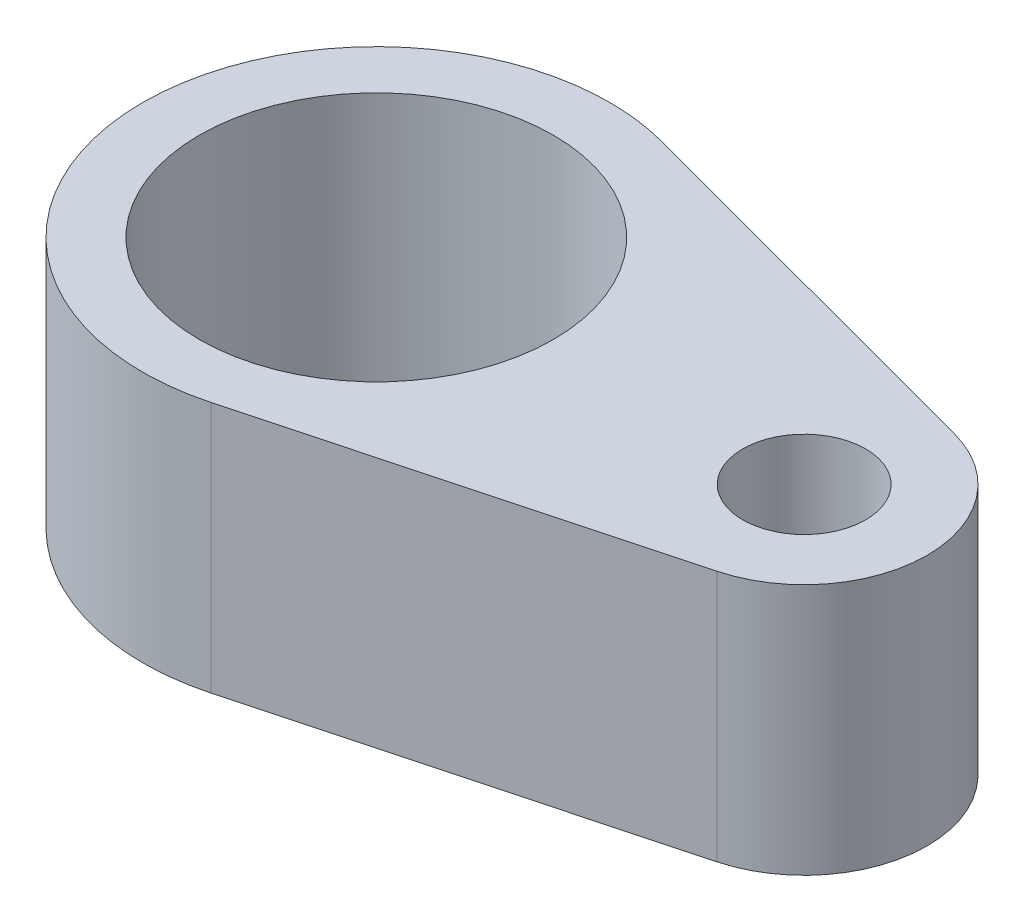
from build123d import *

# Parameters (mm, degrees)
SKETCH2_R           = 9.144
SKETCH2_R_2         = 3.175
BOSS_EXTRUDE1_DEPTH = 13


with BuildPart() as part:
    # Sketch2 → Boss-Extrude1 (new body)
    with BuildSketch(Plane(origin=(0, 0, 0), x_dir=(1, 0, 0), z_dir=(0, 1, 0))):
        with BuildLine():
            Line((3.120258621, 11.654536076), (23.740241379, 6.133966356))
            ThreePointArc((23.740241379, 6.133966356), (28.448, 0), (23.740241379, -6.133966356))
            Line((23.740241379, -6.133966356), (3.120258621, -11.654536076))
            ThreePointArc((3.120258621, -11.654536076), (-12.065, 0), (3.120258621, 11.654536076))
        make_face()
        with Locations(Location((0, 0, 0), (0, 0, 90))):
            Circle(SKETCH2_R, mode=Mode.SUBTRACT)
        with Locations(Location((22.098, 0, 0), (0, 0, 90))):
            Circle(SKETCH2_R_2, mode=Mode.SUBTRACT)
    extrude(amount=BOSS_EXTRUDE1_DEPTH)


solid = part.part
